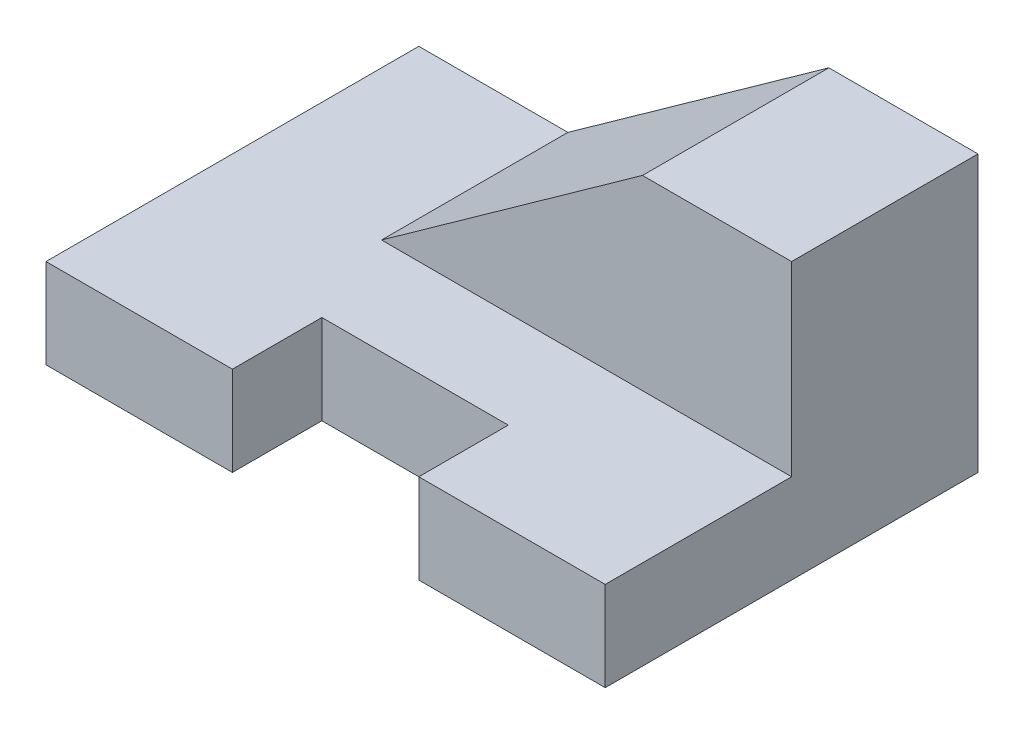
from build123d import *

# Parameters (mm, degrees)
SKETCH1_W             = 25
SKETCH1_H             = 12
BOSS_EXTRUDE1_DEPTH   = 50
BOSS_EXTRUDE1_2_DEPTH = 50
SKETCH1_3_W           = 25
SKETCH1_3_H           = 12
BOSS_EXTRUDE2_DEPTH   = 38
BOSS_EXTRUDE3_DEPTH   = 25


with BuildPart() as part:
    # Sketch1 → Boss-Extrude1 (new body)
    with BuildSketch(Plane.XY):
        with Locations((-12.5, 6)):
            Rectangle(SKETCH1_W, SKETCH1_H)
    extrude(amount=BOSS_EXTRUDE1_DEPTH)



with BuildPart() as body_2:
    # Sketch1 → Boss-Extrude1 2 (new body)
    with BuildSketch(Plane.XY):
        with Locations((-62.5, 6)):
            Rectangle(SKETCH1_W, SKETCH1_H)
    extrude(amount=BOSS_EXTRUDE1_2_DEPTH)


with BuildPart() as part_1:
    add(part.part)

    add(body_2.part)  # Boss-Extrude2 merges body 2
    # Sketch1<3> → Boss-Extrude2 (add)
    with BuildSketch(Plane.XY):
        with Locations((-37.5, 6)):
            Rectangle(SKETCH1_3_W, SKETCH1_3_H)
    extrude(amount=BOSS_EXTRUDE2_DEPTH)

    # Sketch1<4> → Boss-Extrude3 (add)
    with BuildSketch(Plane.XY):
        Polygon((-50, 12), (-25, 12), (0, 12), (0, 37), (-20, 37), (-55, 12), align=None)
    extrude(amount=BOSS_EXTRUDE3_DEPTH)


solid = part_1.part
